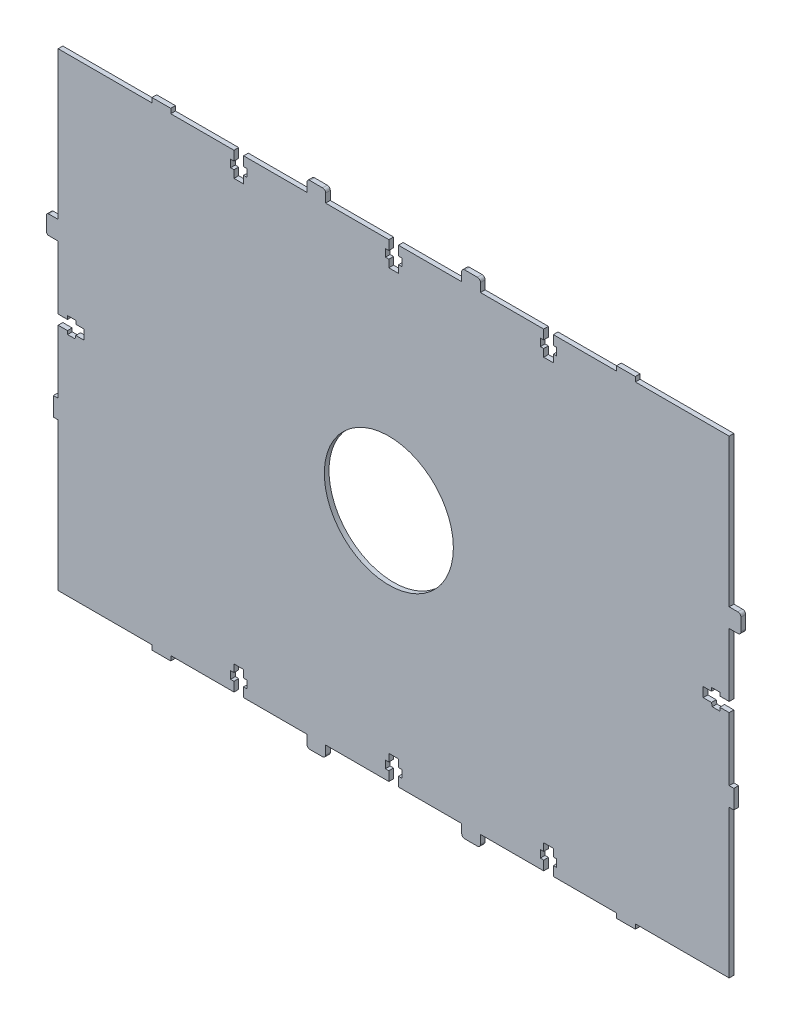
from build123d import *

# Parameters (mm, degrees)
SKETCH_1_R          = 27.5
EXTRUDE_1_DEPTH     = 2
FILLET_1_R          = 1
FILLET_2_R          = 1.3
SKETCH_4_W          = 16.091181195
SKETCH_4_H          = 8.262872831
SKETCH_4_W_2        = 19.931884343
SKETCH_4_W_3        = 14.487561678
SKETCH_4_H_2        = 5.890006991
SKETCH_4_W_4        = 16.715065691
SKETCH_4_H_3        = 8.177759915
SKETCH_4_W_5        = 10.105714663
SKETCH_4_H_4        = 26.066396506
SKETCH_4_W_6        = 5.661455371
SKETCH_4_H_5        = 27.456761526
CUT_EXTRUDE_1_DEPTH = 2


with BuildPart() as part:
    # 草图1 → 凸台-拉伸1 (new body)
    with BuildSketch(Plane.XY):
        Polygon((0, 0), (0, -4), (-1.45, -4), (-1.45, -7.2), (0, -7.2), (0, -10.4), (4.1, -10.4), (4.1, -7.2), (5.55, -7.2), (5.55, -4), (4.1, -4), (4.1, 0), (31.05, 0), (31.05, 5), (39.05, 5), (39.05, 0), (66, 0), (66, -4), (64.55, -4), (64.55, -7.2), (66, -7.2), (66, -10.4), (70.1, -10.4), (70.1, -7.2), (71.55, -7.2), (71.55, -4), (70.1, -4), (70.1, 0), (97.05, 0), (97.05, 5), (105.05, 5), (105.05, 0), (132, 0), (145.05, 0), (145.05, -63), (150.05, -63), (150.05, -71), (145.05, -71), (145.05, -97.95), (141.05, -97.95), (141.05, -96.490258022), (137.515203406, -96.490258022), (137.515203406, -97.95), (133.980406811, -97.95), (133.980406811, -102.05), (137.515203406, -102.05), (137.850237274, -103.470774067), (141.05, -103.509741978), (141.05, -102.05), (145.05, -102.05), (145.05, -129), (150.05, -129), (150.05, -137), (145.05, -137), (145.05, -200), (132, -200), (105.05, -200), (105.05, -205), (97.05, -205), (97.05, -200), (70.1, -200), (70.1, -196), (71.55, -196), (71.55, -192.8), (70.1, -192.8), (70.1, -189.6), (66, -189.6), (66, -192.8), (64.55, -192.8), (64.55, -196), (66, -196), (66, -200), (39.05, -200), (39.05, -205), (31.05, -205), (31.05, -200), (4.1, -200), (4.1, -196), (5.55, -196), (5.55, -192.8), (4.1, -192.8), (4.1, -189.6), (0, -189.6), (0, -192.8), (-1.45, -192.8), (-1.45, -196), (0, -196), (0, -200), (-26.95, -200), (-26.95, -205), (-34.95, -205), (-34.95, -200), (-61.9, -200), (-61.9, -196), (-60.45, -196), (-60.45, -192.8), (-61.9, -192.8), (-61.9, -189.6), (-66, -189.6), (-66, -192.8), (-67.45, -192.8), (-67.45, -196), (-66, -196), (-66, -200), (-92.95, -200), (-92.95, -205), (-100.95, -205), (-100.95, -200), (-127.9, -200), (-140.95, -200), (-140.95, -137), (-145.95, -137), (-145.95, -129), (-140.95, -129), (-140.95, -102.05), (-136.95, -102.05), (-136.95, -103.509741978), (-133.750237274, -103.470774067), (-133.415203406, -102.05), (-129.880406811, -102.05), (-129.880406811, -97.95), (-133.415203406, -97.95), (-133.415203406, -96.490258022), (-136.95, -96.490258022), (-136.95, -97.95), (-140.95, -97.95), (-140.95, -71), (-145.95, -71), (-145.95, -63), (-140.95, -63), (-140.95, 0), (-127.9, 0), (-100.95, 0), (-100.95, 5), (-92.95, 5), (-92.95, 0), (-66, 0), (-66, -4), (-67.45, -4), (-67.45, -7.2), (-66, -7.2), (-66, -10.4), (-61.9, -10.4), (-61.9, -7.2), (-60.45, -7.2), (-60.45, -4), (-61.9, -4), (-61.9, 0), (-34.95, 0), (-34.95, 5), (-26.95, 5), (-26.95, 0), align=None)
        with Locations((0, -100)):
            Circle(SKETCH_1_R, mode=Mode.SUBTRACT)
    extrude(amount=EXTRUDE_1_DEPTH)

    # 圆角1
    fillet_1_edges = [part.edges().sort_by_distance(p)[0] for p in [
        (-145.95, -63, 1),
        (-145.95, -71, 1),
        (-145.95, -129, 1),
        (-145.95, -137, 1),
    ]]
    fillet(fillet_1_edges, radius=FILLET_1_R)

    # 圆角2
    fillet_2_edges = [part.edges().sort_by_distance(p)[0] for p in [
        (39.05, 5, 1),
        (31.05, 5, 1),
        (-26.95, 5, 1),
        (-34.95, 5, 1),
        (-92.95, 5, 1),
        (-100.95, 5, 1),
        (-100.95, -205, 1),
        (-92.95, -205, 1),
        (-34.95, -205, 1),
        (-26.95, -205, 1),
        (31.05, -205, 1),
        (39.05, -205, 1),
        (97.05, -205, 1),
        (105.05, -205, 1),
        (150.05, -137, 1),
        (150.05, -129, 1),
        (150.05, -71, 1),
        (150.05, -63, 1),
        (105.05, 5, 1),
        (97.05, 5, 1),
    ]]
    fillet(fillet_2_edges, radius=FILLET_2_R)

    # 草图4 → 切除-拉伸1 (cut)
    with BuildSketch(Plane.XY.offset(2)):
        with Locations((-95.339833075, 6.131436416)):
            Rectangle(SKETCH_4_W, SKETCH_4_H)
        with Locations((100.859067665, 6.131436416)):
            Rectangle(SKETCH_4_W_2, SKETCH_4_H)
        with Locations((-97.37103045, -204.945003496)):
            Rectangle(SKETCH_4_W_3, SKETCH_4_H_2)
        with Locations((102.467476991, -206.088879958)):
            Rectangle(SKETCH_4_W_4, SKETCH_4_H_3)
        with Locations((-148.002857332, -124.681219337)):
            Rectangle(SKETCH_4_W_5, SKETCH_4_H_4)
        with Locations((149.880727686, -127.664492951)):
            Rectangle(SKETCH_4_W_6, SKETCH_4_H_5)
    extrude(amount=-CUT_EXTRUDE_1_DEPTH, mode=Mode.SUBTRACT)


solid = part.part
